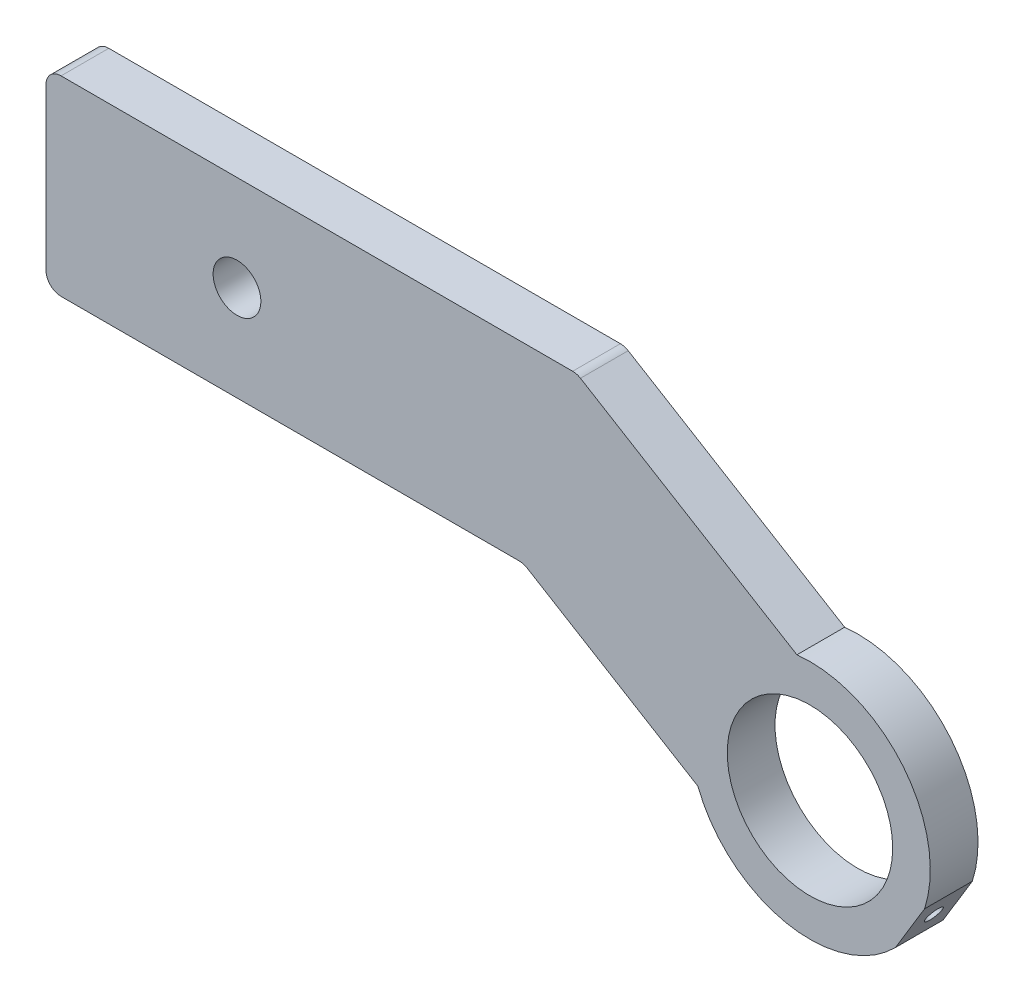
from build123d import *

# Parameters (mm, degrees)
SKETCH1_R               = 3.175
SKETCH1_R_2             = 11
BOSS_EXTRUDE1_DEPTH     = 6.35
CUT_EXTRUDE1_REACH      = 122.068
CUT_EXTRUDE1_END_RADIUS = 11
SKETCH2_R               = 1.1303
SKETCH3_W               = 25.4
SKETCH3_H               = 6.35
SKETCH3_W_2             = 6.35
BOSS_EXTRUDE2_DEPTH     = 4.7625
FILLET3_R               = 2


with BuildPart() as part:
    # Sketch1 → Boss-Extrude1 (new body)
    with BuildSketch(Plane.XY):
        with BuildLine():
            Line((-25.4, -12.7), (-25.4, 12.7))
            Line((-25.4, 12.7), (45.199208724, 12.7))
            Line((45.199208724, 12.7), (74.463216326, -5.044542368))
            ThreePointArc((74.463216326, -5.044542368), (88.585378941, -10.82071629), (91.444603929, -25.808194216))
            Line((91.444603929, -25.808194216), (87.555933896, -32.221324916))
            ThreePointArc((87.555933896, -32.221324916), (72.944550454, -36.615313538), (61.293587146, -26.763678338))
            Line((61.293587146, -26.763678338), (38.1, -12.7))
            Line((38.1, -12.7), (-25.4, -12.7))
        make_face()
        Circle(SKETCH1_R, mode=Mode.SUBTRACT)
        with Locations((76.2, -20.95)):
            Circle(SKETCH1_R_2, mode=Mode.SUBTRACT)
    extrude(amount=BOSS_EXTRUDE1_DEPTH)

    # Cut-Extrude1: up to this cylinder (the profile starts outside it)
    cut_extrude1_end = Plane(origin=(76.2, -20.95, 3.175), z_dir=(0, 0, -1)) * Cylinder(CUT_EXTRUDE1_END_RADIUS, 267.136, mode=Mode.PRIVATE)
    # Sketch2 → Cut-Extrude1 (cut, up to the surface)
    with BuildSketch(Plane(origin=(78.303556067, -47.480194346, 0), x_dir=(0, 0, -1), z_dir=(0.8550840932924629, -0.5184893377864258, 0)), mode=Mode.PRIVATE) as cut_extrude1_sk1:
        with Locations(Location((-3.175, 21.594875785, 0), (0, 0, 90))):
            Circle(SKETCH2_R)
    cut_extrude1_tool1 = extrude(cut_extrude1_sk1.sketch, amount=-CUT_EXTRUDE1_REACH, mode=Mode.PRIVATE) - cut_extrude1_end
    add(cut_extrude1_tool1.solids().sort_by_distance((89.500269, -29.01476, 3.175))[0], mode=Mode.SUBTRACT)

    # Sketch3 → Boss-Extrude2 (add)
    with BuildSketch(Plane.XY):
        with Locations((20.6375, 0)):
            Rectangle(SKETCH3_W, SKETCH3_H)
        with Locations((-15.875, 0)):
            Rectangle(SKETCH3_W_2, SKETCH3_H)
    extrude(amount=-BOSS_EXTRUDE2_DEPTH)

    # Fillet3
    fillet3_edges = [part.edges().sort_by_distance(p)[0] for p in [
        (-25.4, -12.7, 3.175),
        (-25.4, 12.7, 3.175),
        (45.199208724, 12.7, 3.175),
        (38.1, -12.7, 3.175),
        (33.3375, 3.175, -2.38125),
        (33.3375, -3.175, -2.38125),
        (7.9375, -3.175, -2.38125),
        (7.9375, 3.175, -2.38125),
        (-12.7, 3.175, -2.38125),
        (-12.7, -3.175, -2.38125),
        (-19.05, -3.175, -2.38125),
        (-19.05, 3.175, -2.38125),
    ]]
    fillet(fillet3_edges, radius=FILLET3_R)


solid = part.part
